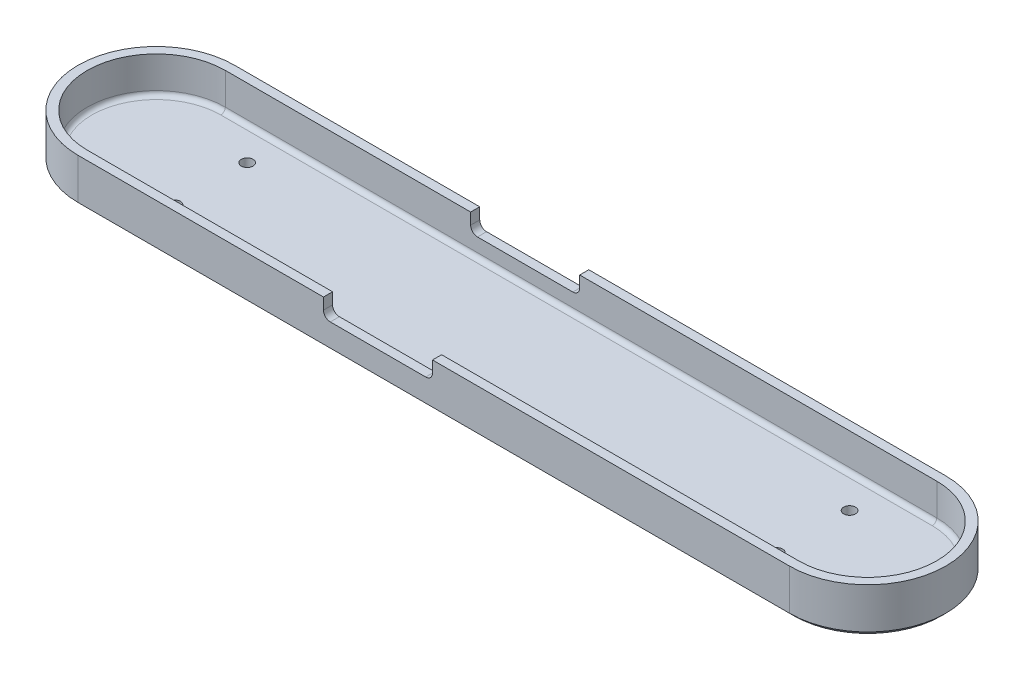
from build123d import *

# Parameters (mm, degrees)
MAINBLOCK_DEPTH               = 2.54
BOSS_EXTRUDE1_DEPTH           = 12.7
SKETCH3_R                     = 1.651
MOUNT_HOLES_DEPTH             = 124.889069578
FILLET1_R                     = 1.27
CHAMFER1_SIZE                 = 1.27
SKETCH4_W                     = 30.48
SKETCH4_H                     = 2.54
STABILIZER_MOUNT_CUTOUT_DEPTH = 5.08
FILLET2_R                     = 1.905


with BuildPart() as part:
    # Sketch1 → MainBlock (new body)
    with BuildSketch(Plane(origin=(0, 0, 0), x_dir=(1, 0, 0), z_dir=(0, 1, 0))):
        with BuildLine():
            Line((-99.441, 19.304), (99.441, 19.304))
            ThreePointArc((99.441, 19.304), (118.745, 0), (99.441, -19.304))
            Line((99.441, -19.304), (-99.441, -19.304))
            ThreePointArc((-99.441, -19.304), (-118.745, 0), (-99.441, 19.304))
        make_face()
    extrude(amount=MAINBLOCK_DEPTH)

    # Sketch2 → Boss-Extrude1 (add)
    with BuildSketch(Plane.XZ):
        with BuildLine():
            Line((-99.441, 21.844), (99.441, 21.844))
            ThreePointArc((99.441, 21.844), (121.285, 0), (99.441, -21.844))
            Line((99.441, -21.844), (-99.441, -21.844))
            ThreePointArc((-99.441, -21.844), (-121.285, 0), (-99.441, 21.844))
        make_face()
        with BuildLine():
            Line((99.441, 19.304), (-99.441, 19.304))
            ThreePointArc((-99.441, 19.304), (-118.745, 0), (-99.441, -19.304))
            Line((-99.441, -19.304), (99.441, -19.304))
            ThreePointArc((99.441, -19.304), (118.745, 0), (99.441, 19.304))
        make_face(mode=Mode.SUBTRACT)
    extrude(amount=-BOSS_EXTRUDE1_DEPTH)

    # Sketch3 → Mount-Holes (cut, through all)
    with BuildSketch(Plane.XZ):
        with Locations(Location((-84.201, 10.16, 0), (0, 0, 270))):
            Circle(SKETCH3_R)
        with Locations(Location((84.201, 10.16, 0), (0, 0, 90))):
            Circle(SKETCH3_R)
        with Locations(Location((84.201, -10.16, 0), (0, 0, 270))):
            Circle(SKETCH3_R)
        with Locations(Location((-84.201, -10.16, 0), (0, 0, 90))):
            Circle(SKETCH3_R)
    extrude(amount=-MOUNT_HOLES_DEPTH, mode=Mode.SUBTRACT)

    # Fillet1
    fillet1_edges = [part.edges().sort_by_distance(p)[0] for p in [
        (118.745, 2.54, 0),
        (0, 2.54, -19.304),
        (-118.745, 2.54, 0),
        (0, 2.54, 19.304),
    ]]
    fillet(fillet1_edges, radius=FILLET1_R)

    # Chamfer1
    chamfer1_edges = [part.edges().sort_by_distance(p)[0] for p in [
        (-121.285, 0, 0),
        (0, 0, -21.844),
        (121.285, 0, 0),
        (0, 0, 21.844),
    ]]
    chamfer(chamfer1_edges, length=CHAMFER1_SIZE)

    # Sketch4 → Stabilizer-Mount-Cutout (cut)
    with BuildSketch(Plane(origin=(0, 12.7, 0), x_dir=(1, 0, 0), z_dir=(0, 1, 0))):
        with Locations((-15.621, 20.574)):
            Rectangle(SKETCH4_W, SKETCH4_H)
    stabilizer_mount_cutout = extrude(amount=-STABILIZER_MOUNT_CUTOUT_DEPTH, mode=Mode.SUBTRACT)

    # Mirror1: Stabilizer-Mount-Cutout across plane
    add(stabilizer_mount_cutout.mirror(Plane.XY), mode=Mode.SUBTRACT)

    # Fillet2
    fillet2_edges = [part.edges().sort_by_distance(p)[0] for p in [
        (-30.861, 7.62, 20.574),
        (-0.381, 7.62, 20.574),
        (-0.381, 7.62, -20.574),
        (-30.861, 7.62, -20.574),
    ]]
    fillet(fillet2_edges, radius=FILLET2_R)


solid = part.part
